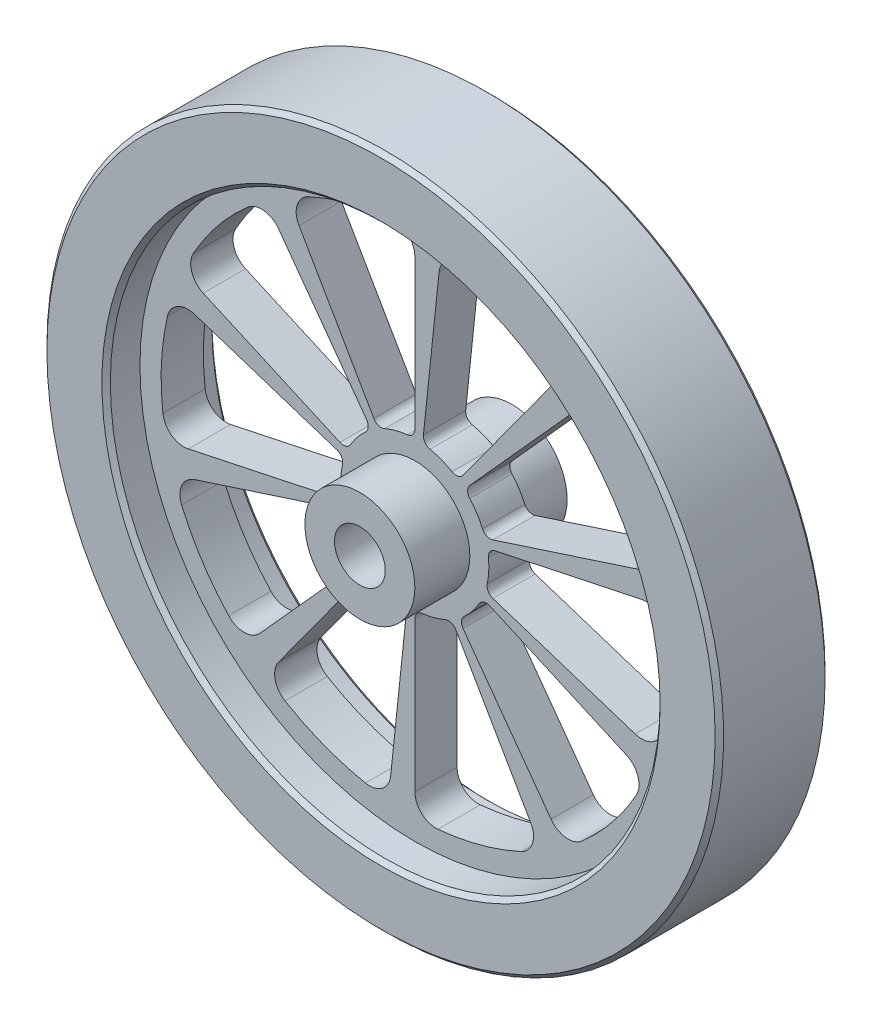
from build123d import *

# Parameters (mm, degrees)
SKETCH3_R           = 80
SKETCH3_R_2         = 6
BOSS_EXTRUDE2_DEPTH = 13
SKETCH4_R           = 65
CUT_EXTRUDE3_DEPTH  = 8
SKETCH5_R           = 13
SKETCH5_R_2         = 6
BOSS_EXTRUDE3_DEPTH = 18
CHAMFER1_SIZE       = 1
CUT_EXTRUDE4_DEPTH  = 116.451288429
CIRPATTERN1_COUNT   = 10


with BuildPart() as part:
    # Sketch3 → Boss-Extrude2 (new, symmetric)
    with BuildSketch(Plane.XY):
        with Locations(Location((0, 0, 0), (0, 0, 180))):
            Circle(SKETCH3_R)
        with Locations(Location((0, 0, 0), (0, 0, 180))):
            Circle(SKETCH3_R_2, mode=Mode.SUBTRACT)
    extrude(amount=BOSS_EXTRUDE2_DEPTH, both=True)

    # Sketch4 → Cut-Extrude3 (cut)
    with BuildSketch(Plane.XY.offset(13)):
        Circle(SKETCH4_R)
    cut_extrude3 = extrude(amount=-CUT_EXTRUDE3_DEPTH, mode=Mode.SUBTRACT)

    # Mirror2: Cut-Extrude3 across plane
    add(cut_extrude3.mirror(Plane.XY), mode=Mode.SUBTRACT)

    # Sketch5 → Boss-Extrude3 (add, symmetric)
    with BuildSketch(Plane.XY):
        with Locations(Location((0, 0, 0), (0, 0, 180))):
            Circle(SKETCH5_R)
        with Locations(Location((0, 0, 0), (0, 0, 180))):
            Circle(SKETCH5_R_2, mode=Mode.SUBTRACT)
    extrude(amount=BOSS_EXTRUDE3_DEPTH, both=True)

    # Chamfer1
    chamfer1_edges = [part.edges().sort_by_distance(p)[0] for p in [
        (-65, 0, 13),
        (-65, 0, -13),
        (80, 0, -13),
        (80, 0, 13),
    ]]
    chamfer(chamfer1_edges, length=CHAMFER1_SIZE)

    # Sketch6 → Cut-Extrude4 (cut, through all)
    with BuildSketch(Plane.XY.offset(5)):
        with BuildLine():
            Line((-27.386127875, 47.434164903), (-9.698582371, 16.798437427))
            ThreePointArc((-9.698582371, 16.798437427), (-8.582686936, 15.895715021), (-7.149451403, 15.972956666))
            ThreePointArc((-7.149451403, 15.972956666), (-4.529333289, 16.90370196), (-1.794871795, 17.407711947))
            ThreePointArc((-1.794871795, 17.407711947), (-0.515032591, 18.057436487), (0, 19.397164741))
            Line((0, 19.397164741), (0, 54.772255751))
            ThreePointArc((0, 54.772255751), (-1.629000688, 58.46500048), (-5.454545455, 59.751551728))
            ThreePointArc((-5.454545455, 59.751551728), (-15.529142706, 57.955549577), (-25.152000934, 54.473634439))
            ThreePointArc((-25.152000934, 54.473634439), (-27.821744262, 51.446675992), (-27.386127875, 47.434164903))
        make_face()
    cut_extrude4 = extrude(amount=-CUT_EXTRUDE4_DEPTH, mode=Mode.SUBTRACT)

    # CirPattern1: Cut-Extrude4 ×10 about axis
    cirpattern1_axis = Axis((0, 0, 0), (0, 0, 1))
    for i in range(1, CIRPATTERN1_COUNT):
        add(cut_extrude4.rotate(cirpattern1_axis, i * 360 / CIRPATTERN1_COUNT), mode=Mode.SUBTRACT)


solid = part.part
